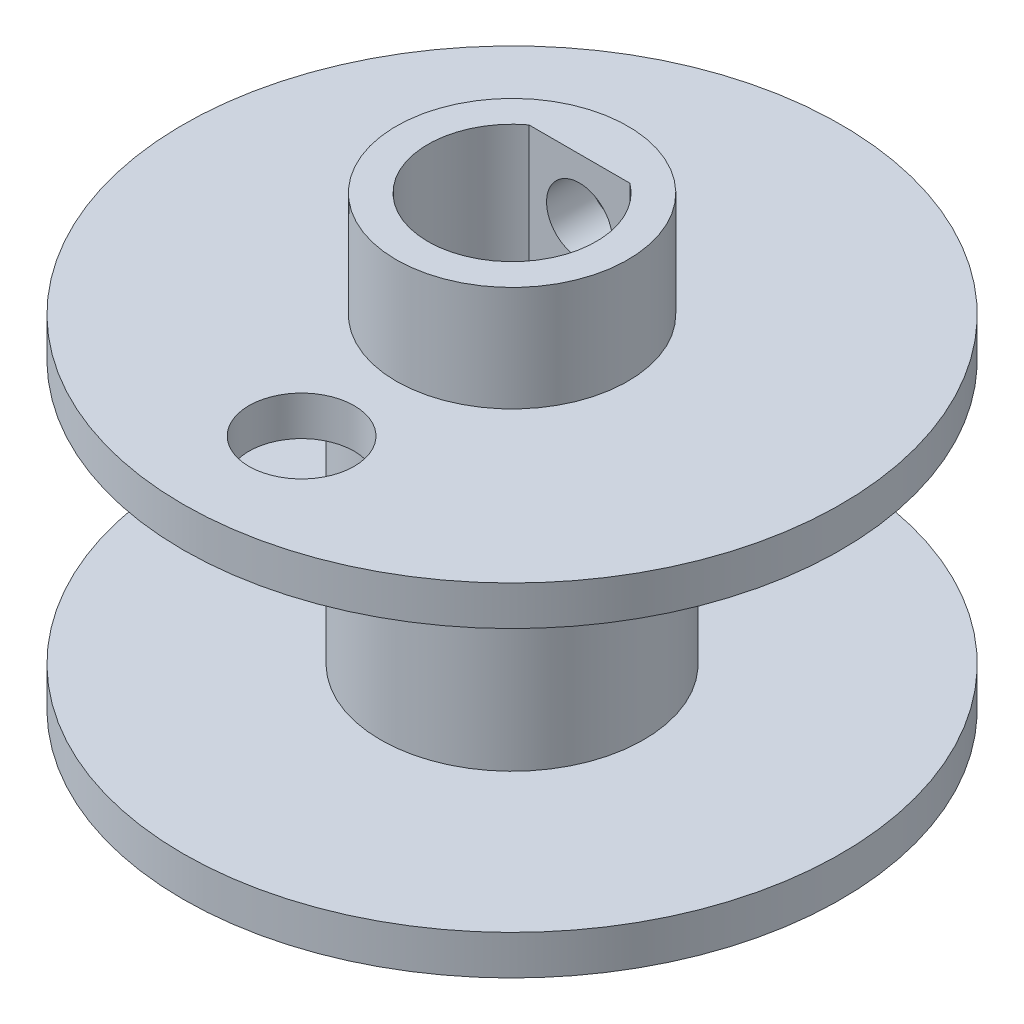
from build123d import *

# Parameters (mm, degrees)
SKETCH2_R               = 5
BOSS_EXTRUDE1_DEPTH     = 5
SKETCH3_R               = 12.5
BOSS_EXTRUDE2_DEPTH     = 1.5
CUT_EXTRUDE1_DEPTH      = 22.943108257
CUT_EXTRUDE1_DEPTH_BACK = 22.943108257
SKETCH5_R               = 4.4
BOSS_EXTRUDE3_DEPTH     = 4
CUT_EXTRUDE2_DEPTH      = 25.525496937
SKETCH7_R               = 1.25
CUT_EXTRUDE3_DEPTH      = 23.210438987
SKETCH9_R               = 2
CUT_EXTRUDE4_DEPTH      = 22.089096709


with BuildPart() as part:
    # Sketch2 → Boss-Extrude1 (new, symmetric)
    with BuildSketch(Plane(origin=(0, 0, 0), x_dir=(1, 0, 0), z_dir=(0, 1, 0))):
        with Locations(Location((0, 0, 0), (0, 0, 270))):
            Circle(SKETCH2_R)
    extrude(amount=BOSS_EXTRUDE1_DEPTH, both=True)

    # Sketch3 → Boss-Extrude2 (add)
    with BuildSketch(Plane(origin=(0, 5, 0), x_dir=(1, 0, 0), z_dir=(0, 1, 0))):
        with Locations(Location((0, 0, 0), (0, 0, 270))):
            Circle(SKETCH3_R)
    boss_extrude2 = extrude(amount=BOSS_EXTRUDE2_DEPTH)

    # Mirror1: Boss-Extrude2 across plane
    add(boss_extrude2.mirror(Plane.ZX))

    # Sketch4 → Cut-Extrude1 (cut, two sides: drawn at the far end of the back side and taken through both)
    with BuildSketch(Plane(origin=(0, 6.5, 0), x_dir=(1, 0, 0), z_dir=(0, 1, 0)).offset(-CUT_EXTRUDE1_DEPTH_BACK)):
        with BuildLine():
            Line((-1.92, 2.56), (1.92, 2.56))
            ThreePointArc((1.92, 2.56), (0, -3.2), (-1.92, 2.56))
        make_face()
    extrude(amount=CUT_EXTRUDE1_DEPTH + CUT_EXTRUDE1_DEPTH_BACK, mode=Mode.SUBTRACT)

    # Sketch5 → Boss-Extrude3 (add)
    with BuildSketch(Plane(origin=(0, 6.5, 0), x_dir=(1, 0, 0), z_dir=(0, 1, 0))):
        with Locations(Location((0, 0, 0), (0, 0, 270))):
            Circle(SKETCH5_R)
    extrude(amount=BOSS_EXTRUDE3_DEPTH)

    # Sketch6 → Cut-Extrude2 (cut, through all)
    with BuildSketch(Plane(origin=(0, 10.5, 0), x_dir=(1, 0, 0), z_dir=(0, 1, 0))):
        with BuildLine():
            Line((-1.92, 2.56), (1.92, 2.56))
            ThreePointArc((1.92, 2.56), (0, -3.2), (-1.92, 2.56))
        make_face()
    extrude(amount=-CUT_EXTRUDE2_DEPTH, mode=Mode.SUBTRACT)

    # Sketch7 → Cut-Extrude3 (cut, through all)
    with BuildSketch(Plane.XY.offset(-2.56)):
        with Locations((0, 8.3)):
            Circle(SKETCH7_R)
    extrude(amount=-CUT_EXTRUDE3_DEPTH, mode=Mode.SUBTRACT)

    # Sketch9 → Cut-Extrude4 (cut, through all)
    with BuildSketch(Plane.XZ.offset(-5)):
        with Locations(Location((0, 8, 0), (0, 0, 270))):
            Circle(SKETCH9_R)
    extrude(amount=-CUT_EXTRUDE4_DEPTH, mode=Mode.SUBTRACT)


solid = part.part
